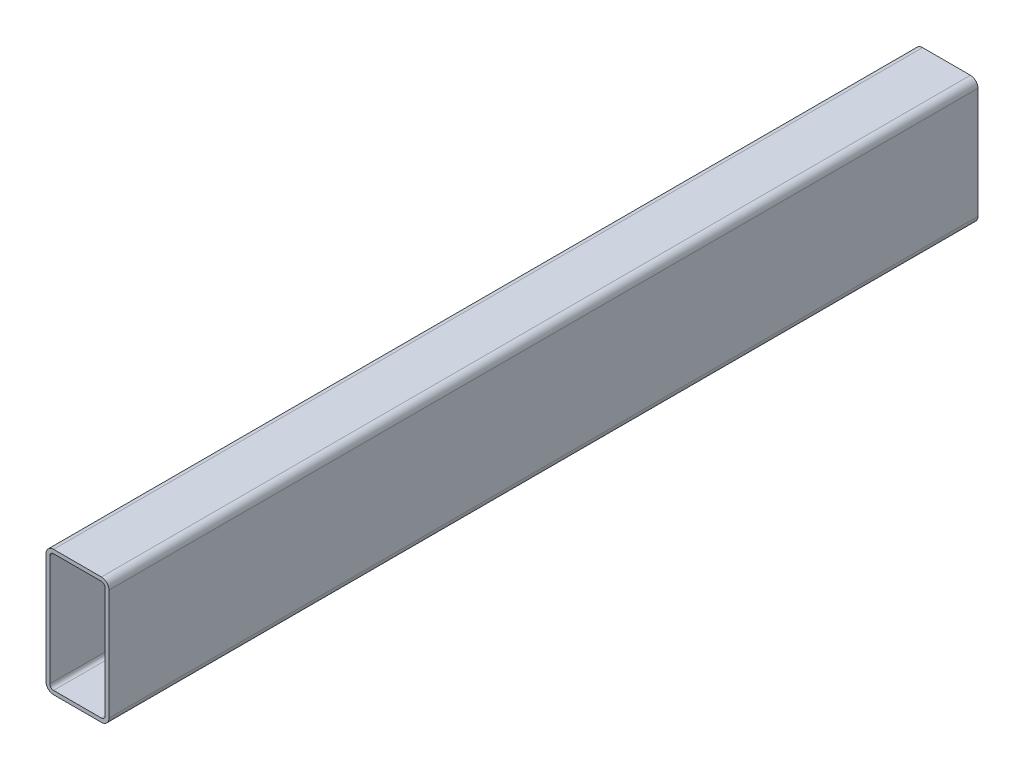
from build123d import *

# Parameters (mm, degrees)
AUFSATZ_LINEAR_AUSTRAGEN1_DEPTH = 345


with BuildPart() as part:
    # Skizze1 → Aufsatz-Linear austragen1 (new, symmetric)
    with BuildSketch(Plane.XY):
        with BuildLine():
            Line((-19, 50), (19, 50))
            ThreePointArc((19, 50), (23.242640687, 48.242640687), (25, 44))
            Line((25, 44), (25, -44))
            ThreePointArc((25, -44), (23.242640687, -48.242640687), (19, -50))
            Line((19, -50), (-19, -50))
            ThreePointArc((-19, -50), (-23.242640687, -48.242640687), (-25, -44))
            Line((-25, -44), (-25, 44))
            ThreePointArc((-25, 44), (-23.242640687, 48.242640687), (-19, 50))
        make_face()
        with BuildLine():
            Line((-22, 44), (-22, -44))
            ThreePointArc((-22, -44), (-21.121320344, -46.121320344), (-19, -47))
            Line((-19, -47), (19, -47))
            ThreePointArc((19, -47), (21.121320344, -46.121320344), (22, -44))
            Line((22, -44), (22, 44))
            ThreePointArc((22, 44), (21.121320344, 46.121320344), (19, 47))
            Line((19, 47), (-19, 47))
            ThreePointArc((-19, 47), (-21.121320344, 46.121320344), (-22, 44))
        make_face(mode=Mode.SUBTRACT)
    extrude(amount=AUFSATZ_LINEAR_AUSTRAGEN1_DEPTH, both=True)


solid = part.part
